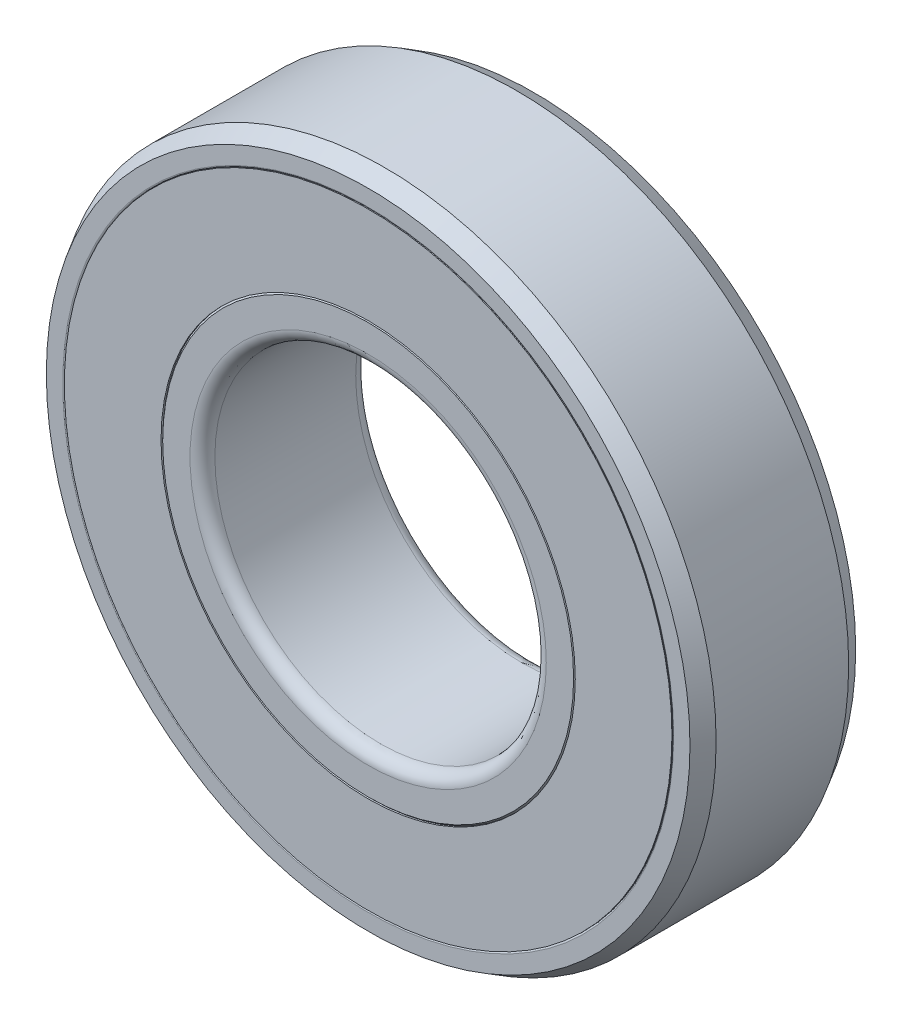
from build123d import *

# Parameters (mm, degrees)
SKETCH4_W         = 0.291666667
SKETCH4_H         = 2.333333333
CIRPATTERN1_COUNT = 7


with BuildPart() as part:
    # Sketch3 → Revolve1 (revolve)
    with BuildSketch(Plane(origin=(0, 0, 0), x_dir=(0, 0, -1), z_dir=(1, 0, 0)), mode=Mode.PRIVATE) as revolve1_sk:
        with BuildLine():
            Line((-1.6, -8), (1.6, -8))
            Line((1.6, -8), (2, -7.769059892))
            Line((2, -7.769059892), (2, -7.373333333))
            ThreePointArc((2, -7.373333333), (1.988284271, -7.345049062), (1.96, -7.333333333))
            Line((1.96, -7.333333333), (1.111111111, -7.333333333))
            ThreePointArc((1.111111111, -7.333333333), (0, -7.777777778), (-1.111111111, -7.333333333))
            Line((-1.111111111, -7.333333333), (-1.96, -7.333333333))
            ThreePointArc((-1.96, -7.333333333), (-1.988284271, -7.345049062), (-2, -7.373333333))
            Line((-2, -7.373333333), (-2, -7.769059892))
            Line((-2, -7.769059892), (-1.6, -8))
        make_face()
        with BuildLine():
            Line((-1.7, -4), (1.7, -4))
            ThreePointArc((1.7, -4), (1.912132034, -4.087867966), (2, -4.3))
            Line((2, -4.3), (2, -4.96))
            Line((2, -4.96), (1.96, -5))
            Line((1.96, -5), (1.111111111, -5))
            ThreePointArc((1.111111111, -5), (0, -4.555555556), (-1.111111111, -5))
            Line((-1.111111111, -5), (-1.96, -5))
            Line((-1.96, -5), (-2, -4.96))
            Line((-2, -4.96), (-2, -4.3))
            ThreePointArc((-2, -4.3), (-1.912132034, -4.087867966), (-1.7, -4))
        make_face()
    revolve(revolve1_sk.sketch.rotate(Axis((0, 0, 2), (0, 0, -1)), 270), axis=Axis((0, 0, 2), (0, 0, -1)))


with BuildPart() as body_2:
    # Sketch4 → Revolve2 (revolve)
    with BuildSketch(Plane(origin=(0, 0, 0), x_dir=(0, 0, -1), z_dir=(1, 0, 0)), mode=Mode.PRIVATE) as revolve2_sk:
        with Locations((-1.854166667, -6.166666667)):
            Rectangle(SKETCH4_W, SKETCH4_H)
    revolve(revolve2_sk.sketch.rotate(Axis((0, 0, 2), (0, 0, -1)), 270), axis=Axis((0, 0, 2), (0, 0, -1)))


with BuildPart() as body_3:
    # Sketch5 → Revolve3 (revolve)
    with BuildSketch(Plane(origin=(0, 0, 0), x_dir=(0, 0, -1), z_dir=(1, 0, 0))):
        with BuildLine():
            Line((0, -4.555555556), (0, -7.777777778))
            ThreePointArc((0, -7.777777778), (-1.611111111, -6.166666667), (0, -4.555555556))
        make_face()
    revolve(axis=Axis((0, 0, 0), (0, -1, 0)))


with BuildPart() as cirpattern1_1:
    # CirPattern1: pattern copy
    add(body_3.part.rotate(Axis((0, 0, 0), (0, 0, 1)), 1 * 360 / CIRPATTERN1_COUNT))


with BuildPart() as cirpattern1_2:
    # CirPattern1: pattern copy
    add(body_3.part.rotate(Axis((0, 0, 0), (0, 0, 1)), 2 * 360 / CIRPATTERN1_COUNT))


with BuildPart() as cirpattern1_3:
    # CirPattern1: pattern copy
    add(body_3.part.rotate(Axis((0, 0, 0), (0, 0, 1)), 3 * 360 / CIRPATTERN1_COUNT))


with BuildPart() as cirpattern1_4:
    # CirPattern1: pattern copy
    add(body_3.part.rotate(Axis((0, 0, 0), (0, 0, 1)), 4 * 360 / CIRPATTERN1_COUNT))


with BuildPart() as cirpattern1_5:
    # CirPattern1: pattern copy
    add(body_3.part.rotate(Axis((0, 0, 0), (0, 0, 1)), 5 * 360 / CIRPATTERN1_COUNT))


with BuildPart() as cirpattern1_6:
    # CirPattern1: pattern copy
    add(body_3.part.rotate(Axis((0, 0, 0), (0, 0, 1)), 6 * 360 / CIRPATTERN1_COUNT))


solid = Compound([part.part, body_2.part, body_3.part, cirpattern1_1.part, cirpattern1_2.part, cirpattern1_3.part, cirpattern1_4.part, cirpattern1_5.part, cirpattern1_6.part])
